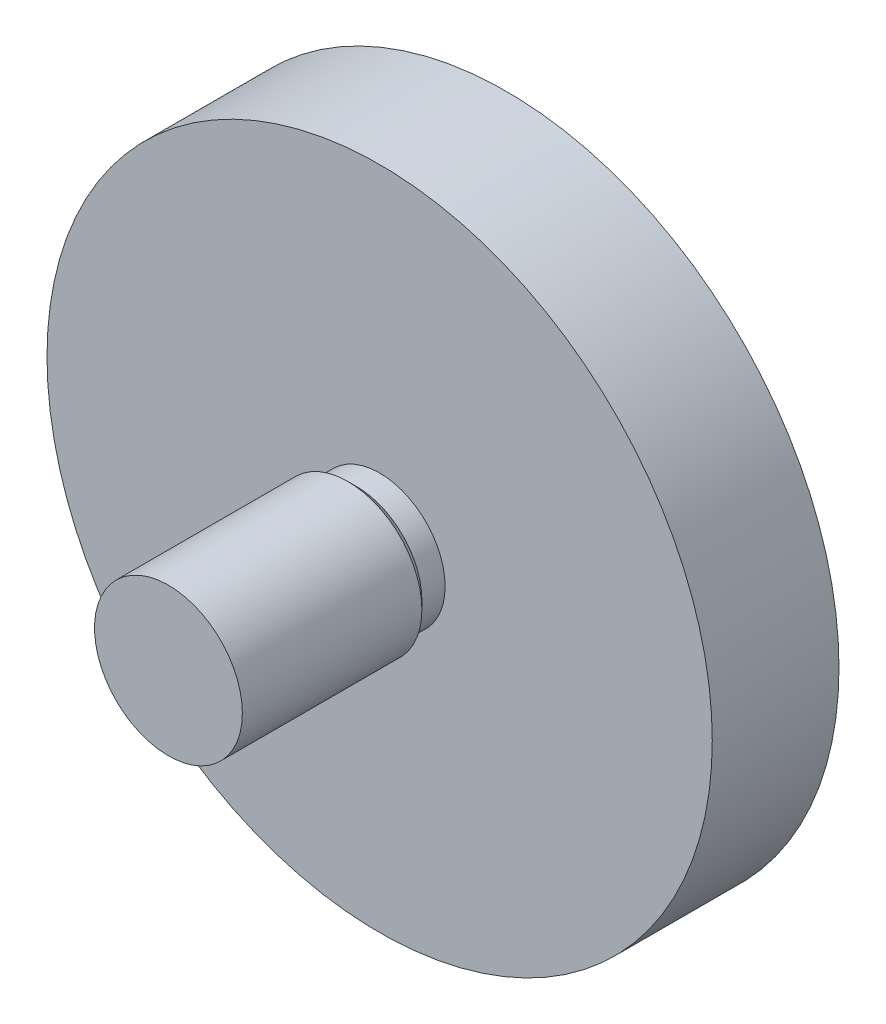
from build123d import *


with BuildPart() as part:
    # Sketch1 → Revolve1 (revolve)
    with BuildSketch(Plane(origin=(0, 0, 0), x_dir=(0, 0, -1), z_dir=(1, 0, 0)), mode=Mode.PRIVATE) as revolve1_sk:
        Polygon((8, 0), (8, 6), (0, 6), (0, 31.5), (-12, 31.5), (-12, 6.2), (-14.2, 6.2), (-15, 7), (-32, 7), (-32, 0), align=None)
    revolve(revolve1_sk.sketch.rotate(Axis((0, 0, -8), (0, 0, -1)), 90), axis=Axis((0, 0, -8), (0, 0, -1)))


solid = part.part
